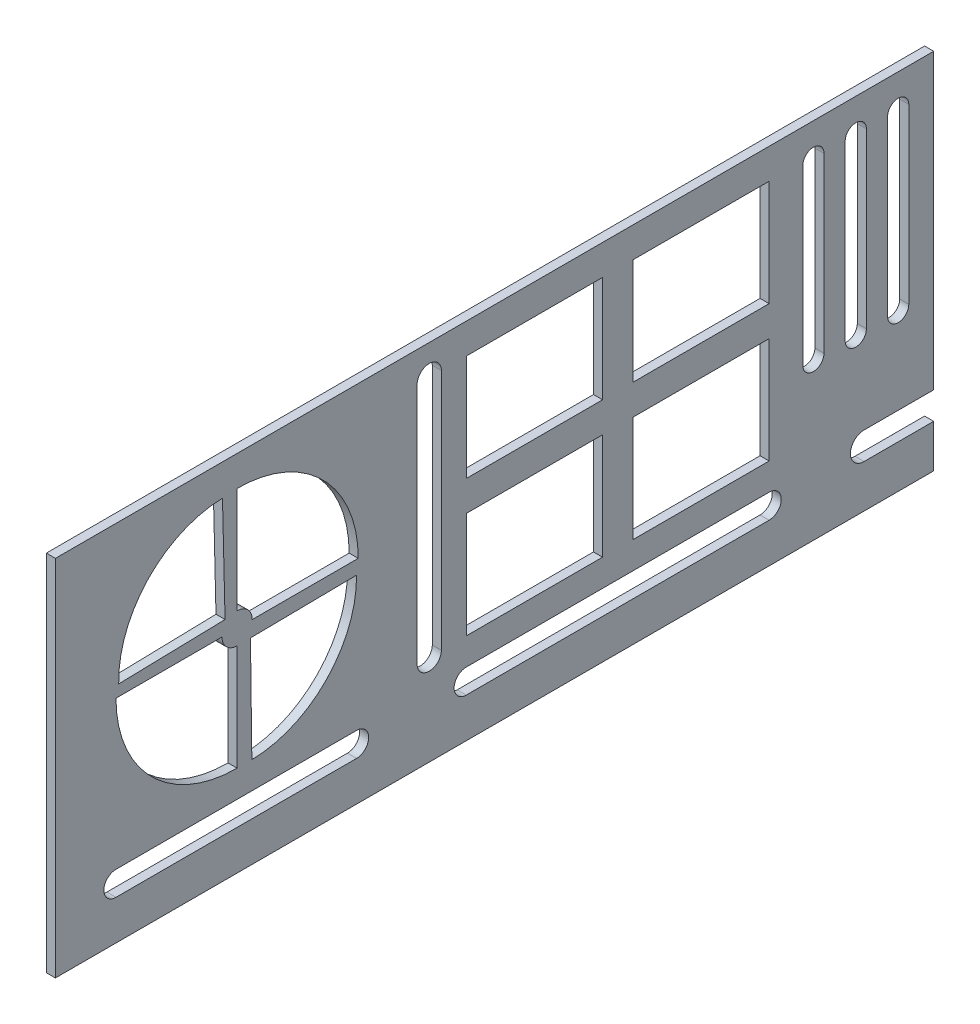
from build123d import *

# Parameters (mm, degrees)
SKETCH_1_W           = 290
SKETCH_1_H           = 120
EXTRUDE_1_DEPTH      = 3
CUT_EXTRUDE_5_DEPTH  = 10
CUT_EXTRUDE_6_DEPTH  = 3
SKETCH_4_W           = 45
SKETCH_4_H           = 35
CUT_EXTRUDE_10_DEPTH = 10
CUT_EXTRUDE_11_DEPTH = 3
CUT_EXTRUDE_12_DEPTH = 3
CUT_EXTRUDE_13_DEPTH = 3


with BuildPart() as part:
    # 草图1 → 凸台-拉伸1 (new body)
    with BuildSketch(Plane(origin=(0, 0, 0), x_dir=(0, 0, -1), z_dir=(1, 0, 0))):
        with Locations((124.096517683, -26.682755594)):
            Rectangle(SKETCH_1_W, SKETCH_1_H)
    extrude(amount=EXTRUDE_1_DEPTH)

    # 草图2 → 切除-拉伸5 (cut)
    with BuildSketch(Plane.ZY):
        with BuildLine():
            ThreePointArc((-39.096517683, 23.317244406), (-67.38078893, 11.601515654), (-79.096517683, -16.682755594))
            Line((-79.096517683, -16.682755594), (-44.096517683, -16.682755594))
            ThreePointArc((-44.096517683, -16.682755594), (-42.632051589, -13.147221688), (-39.096517683, -11.682755594))
            Line((-39.096517683, -11.682755594), (-39.096517683, 23.317244406))
        make_face()
        with BuildLine():
            Line((0.903482317, -16.682755594), (-34.096517683, -16.682755594))
            ThreePointArc((-34.096517683, -16.682755594), (-35.560983777, -20.2182895), (-39.096517683, -21.682755594))
            Line((-39.096517683, -21.682755594), (-39.096517683, -56.682755594))
            ThreePointArc((-39.096517683, -56.682755594), (-10.812246435, -44.967026841), (0.903482317, -16.682755594))
        make_face()
    extrude(amount=-CUT_EXTRUDE_5_DEPTH, mode=Mode.SUBTRACT)

    # 草图3 → 切除-拉伸6 (cut)
    with BuildSketch(Plane.ZY):
        with BuildLine():
            Line((-78.531190081, -21.204087707), (-43.506744141, -21.658309654))
            Line((-43.506744141, -21.658309654), (-43.960966088, -56.682755594))
            ThreePointArc((-43.960966088, -56.682755594), (-68.593950791, -46.103149466), (-78.531190081, -21.204087707))
        make_face()
        with BuildLine():
            Line((-34.265995521, 22.933541451), (-35.119719469, -12.186178019))
            Line((-35.119719469, -12.186178019), (0, -13.039901967))
            ThreePointArc((0, -13.039901967), (-9.682653686, 12.043539778), (-34.265995521, 22.933541451))
        make_face()
    extrude(amount=-CUT_EXTRUDE_6_DEPTH, mode=Mode.SUBTRACT)

    # 草图4 → 切除-拉伸10 (cut)
    with BuildSketch(Plane.ZY):
        with Locations((-192.258808878, 5.817244406)):
            Rectangle(SKETCH_4_W, SKETCH_4_H)
        with Locations((-137.258808878, 5.817244406)):
            Rectangle(SKETCH_4_W, SKETCH_4_H)
        with Locations((-192.258808878, -39.182755594)):
            Rectangle(SKETCH_4_W, SKETCH_4_H)
        with Locations((-137.258808878, -39.182755594)):
            Rectangle(SKETCH_4_W, SKETCH_4_H)
    extrude(amount=-CUT_EXTRUDE_10_DEPTH, mode=Mode.SUBTRACT)

    # 草图5 → 切除-拉伸11 (cut)
    with BuildSketch(Plane.ZY):
        with BuildLine():
            Line((-239.875713673, 22.237845944), (-239.875713673, -34.9202452))
            ThreePointArc((-239.875713673, -34.9202452), (-243.375713673, -38.4202452), (-246.875713673, -34.9202452))
            Line((-246.875713673, -34.9202452), (-246.875713673, 22.237845944))
            ThreePointArc((-246.875713673, 22.237845944), (-243.375713673, 25.737845944), (-239.875713673, 22.237845944))
        make_face()
        with BuildLine():
            Line((-225.875713673, 22.237845944), (-225.875713673, -34.9202452))
            ThreePointArc((-225.875713673, -34.9202452), (-229.375713673, -38.4202452), (-232.875713673, -34.9202452))
            Line((-232.875713673, -34.9202452), (-232.875713673, 22.237845944))
            ThreePointArc((-232.875713673, 22.237845944), (-229.375713673, 25.737845944), (-225.875713673, 22.237845944))
        make_face()
        with BuildLine():
            Line((-253.875713673, 22.237845944), (-253.875713673, -34.9202452))
            ThreePointArc((-253.875713673, -34.9202452), (-257.375713673, -38.4202452), (-260.875713673, -34.9202452))
            Line((-260.875713673, -34.9202452), (-260.875713673, 22.237845944))
            ThreePointArc((-260.875713673, 22.237845944), (-257.375713673, 25.737845944), (-253.875713673, 22.237845944))
        make_face()
    extrude(amount=-CUT_EXTRUDE_11_DEPTH, mode=Mode.SUBTRACT)

    # 草图6 → 切除-拉伸12 (cut)
    with BuildSketch(Plane.ZY):
        with BuildLine():
            Line((-214.758808878, -65.609469687), (-114.758808878, -65.609469687))
            ThreePointArc((-114.758808878, -65.609469687), (-110.758808878, -69.609469687), (-114.758808878, -73.609469687))
            Line((-114.758808878, -73.609469687), (-214.758808878, -73.609469687))
            ThreePointArc((-214.758808878, -73.609469687), (-218.758808878, -69.609469687), (-214.758808878, -65.609469687))
        make_face()
        with BuildLine():
            Line((-98.541599086, 23.317244406), (-98.541599086, -56.682755594))
            ThreePointArc((-98.541599086, -56.682755594), (-102.541599086, -60.682755594), (-106.541599086, -56.682755594))
            Line((-106.541599086, -56.682755594), (-106.541599086, 23.317244406))
            ThreePointArc((-106.541599086, 23.317244406), (-102.541599086, 27.317244406), (-98.541599086, 23.317244406))
        make_face()
        with BuildLine():
            Line((0.903482317, -73.609469687), (-78.534135294, -73.609469687))
            ThreePointArc((-78.534135294, -73.609469687), (-82.534135294, -69.609469687), (-78.534135294, -65.609469687))
            Line((-78.534135294, -65.609469687), (0.903482317, -65.609469687))
            ThreePointArc((0.903482317, -65.609469687), (4.903482317, -69.609469687), (0.903482317, -73.609469687))
        make_face()
    extrude(amount=-CUT_EXTRUDE_12_DEPTH, mode=Mode.SUBTRACT)

    # 草图7 → 切除-拉伸13 (cut)
    with BuildSketch(Plane.ZY):
        with BuildLine():
            Line((-269.096517683, -72.501000298), (-246.096517683, -72.501000298))
            ThreePointArc((-246.096517683, -72.501000298), (-241.596517683, -68.001000298), (-246.096517683, -63.501000298))
            Line((-246.096517683, -63.501000298), (-269.096517683, -63.501000298))
            Line((-269.096517683, -63.501000298), (-269.096517683, -72.501000298))
        make_face()
    extrude(amount=-CUT_EXTRUDE_13_DEPTH, mode=Mode.SUBTRACT)


solid = part.part
